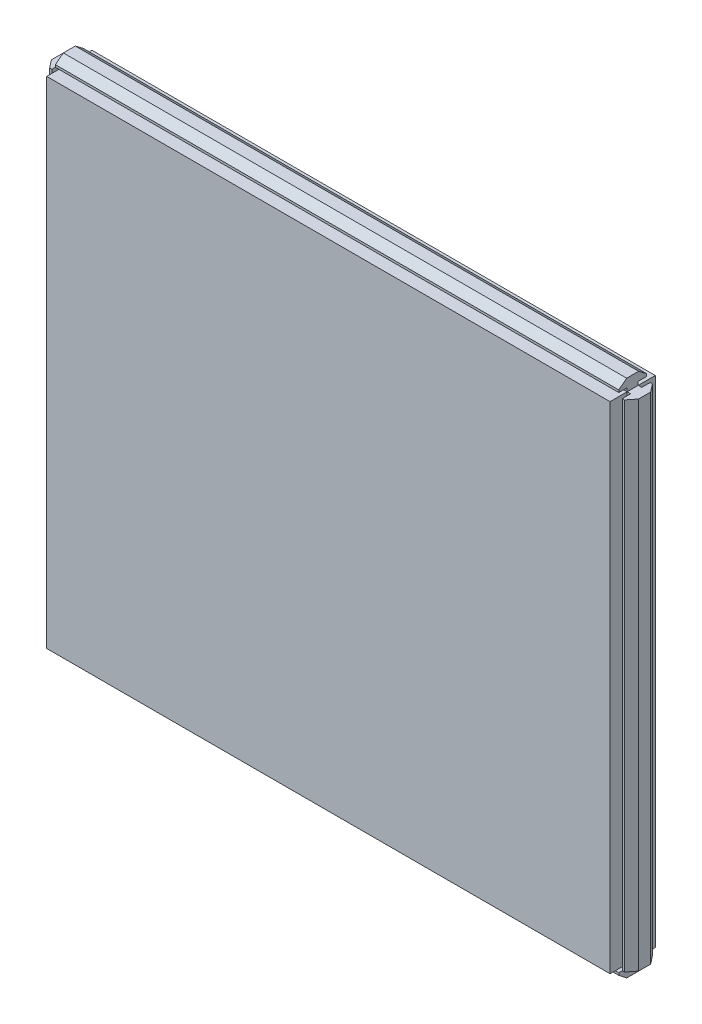
from build123d import *

# Parameters (mm, degrees)
BOSS_EXTRU_1_DEPTH            = 20
ENL_V_MAT_EXTRU_2_DEPTH       = 324.482768921
ENL_V_MAT_EXTRU_2_DEPTH_BACK  = 249
ENL_V_MAT_EXTRU_3_DEPTH       = 324.482768921
ENL_V_MAT_EXTRU_3_DEPTH_BACK  = 249
ENL_V_MAT_EXTRU_4_DEPTH       = 316.090774845
ENL_V_MAT_EXTRU_4_DEPTH_BACK  = 219
ENL_V_MAT_EXTRU_5_DEPTH       = 316.090774845
ENL_V_MAT_EXTRU_5_DEPTH_BACK  = 219
ENL_V_MAT_EXTRU_7_DEPTH       = 316.090774845
ENL_V_MAT_EXTRU_7_DEPTH_BACK  = 219
ENL_V_MAT_EXTRU_8_DEPTH       = 316.090774845
ENL_V_MAT_EXTRU_8_DEPTH_BACK  = 219
ENL_V_MAT_EXTRU_9_DEPTH       = 324.482768921
ENL_V_MAT_EXTRU_9_DEPTH_BACK  = 249
ENL_V_MAT_EXTRU_10_DEPTH      = 324.482768921
ENL_V_MAT_EXTRU_10_DEPTH_BACK = 249


with BuildPart() as part:
    # Esquisse1 → Boss.-Extru.1 (new body)
    with BuildSketch(Plane.XY):
        Polygon((-33.910103697, 30.671339951), (215.089896303, 30.671339951), (215.089896303, 25.371339951), (220.389896303, 25.371339951), (220.389896303, -193.628660049), (215.089896303, -193.628660049), (215.089896303, -198.928660049), (-33.910103697, -198.928660049), (-33.910103697, -193.628660049), (-39.210103697, -193.628660049), (-39.210103697, 25.371339951), (-33.910103697, 25.371339951), align=None)
    extrude(amount=BOSS_EXTRU_1_DEPTH)

    # Esquisse2 → Enlèv. mat.-Extru.2 (cut, two sides: drawn at the far end of the back side and taken through both)
    with BuildSketch(Plane(origin=(215.089896303, 0, 0), x_dir=(0, 0, -1), z_dir=(1, 0, 0)).offset(-ENL_V_MAT_EXTRU_2_DEPTH_BACK)):
        Polygon((-489.896433994, 25.371339951), (-20, 25.371339951), (-12.45, 25.371339951), (-12.45, 26.921339951), (-16.15, 26.921339951), (-16.15, 27.921339951), (-12.65, 30.671339951), (356.838183396, 320.983484048), (47.072753092, 1208.257969711), (-799.661864298, 912.645825614), align=None)
    extrude(amount=ENL_V_MAT_EXTRU_2_DEPTH + ENL_V_MAT_EXTRU_2_DEPTH_BACK, mode=Mode.SUBTRACT)

    # Esquisse3 → Enlèv. mat.-Extru.3 (cut, two sides: drawn at the far end of the back side and taken through both)
    with BuildSketch(Plane(origin=(215.089896303, 0, 0), x_dir=(0, 0, -1), z_dir=(1, 0, 0)).offset(-ENL_V_MAT_EXTRU_3_DEPTH_BACK)):
        Polygon((469.896433994, 25.371339951), (0, 25.371339951), (-7.55, 25.371339951), (-7.55, 26.921339951), (-3.85, 26.921339951), (-3.85, 28.020478953), (-7.35, 30.671339951), (-381.934453377, 314.377430771), (-79.989898168, 1204.343789854), (771.840989202, 915.337699034), align=None)
    extrude(amount=ENL_V_MAT_EXTRU_3_DEPTH + ENL_V_MAT_EXTRU_3_DEPTH_BACK, mode=Mode.SUBTRACT)

    # Esquisse5 → Enlèv. mat.-Extru.4 (cut, two sides: drawn at the far end of the back side and taken through both)
    with BuildSketch(Plane(origin=(0, 25.371339951, 0), x_dir=(1, 0, 0), z_dir=(0, 1, 0)).offset(-ENL_V_MAT_EXTRU_4_DEPTH_BACK)):
        Polygon((215.089896303, 0), (215.089896303, -7.55), (216.639896303, -7.55), (216.639896303, -3.85), (217.639896303, -3.85), (220.389896303, -7.35), (220.389896303, 0), align=None)
    extrude(amount=ENL_V_MAT_EXTRU_4_DEPTH + ENL_V_MAT_EXTRU_4_DEPTH_BACK, mode=Mode.SUBTRACT)

    # Esquisse7 → Enlèv. mat.-Extru.5 (cut, two sides: drawn at the far end of the back side and taken through both)
    with BuildSketch(Plane(origin=(0, 25.371339951, 0), x_dir=(1, 0, 0), z_dir=(0, 1, 0)).offset(-ENL_V_MAT_EXTRU_5_DEPTH_BACK)):
        Polygon((547.721673026, 403.954079466), (220.389896303, -12.65), (217.639896303, -16.15), (216.639896303, -16.15), (216.639896303, -12.45), (215.089896303, -12.45), (215.089896303, -20), (215.089896303, -549.816054004), (1215.620408753, -898.755730707), (1548.252185476, 55.014402763), align=None)
    extrude(amount=ENL_V_MAT_EXTRU_5_DEPTH + ENL_V_MAT_EXTRU_5_DEPTH_BACK, mode=Mode.SUBTRACT)

    # Esquisse9 → Enlèv. mat.-Extru.7 (cut, two sides: drawn at the far end of the back side and taken through both)
    with BuildSketch(Plane(origin=(0, 25.371339951, 0), x_dir=(1, 0, 0), z_dir=(0, 1, 0)).offset(-ENL_V_MAT_EXTRU_7_DEPTH_BACK)):
        Polygon((-33.910103697, -20), (-33.910103697, -12.45), (-35.460103697, -12.45), (-35.460103697, -16.15), (-36.460103697, -16.15), (-39.210103697, -12.65), (-39.210103697, -20), align=None)
    extrude(amount=ENL_V_MAT_EXTRU_7_DEPTH + ENL_V_MAT_EXTRU_7_DEPTH_BACK, mode=Mode.SUBTRACT)

    # Esquisse10 → Enlèv. mat.-Extru.8 (cut, two sides: drawn at the far end of the back side and taken through both)
    with BuildSketch(Plane(origin=(0, 25.371339951, 0), x_dir=(1, 0, 0), z_dir=(0, 1, 0)).offset(-ENL_V_MAT_EXTRU_8_DEPTH_BACK)):
        Polygon((-366.54188042, -423.954079466), (-39.210103697, -7.35), (-36.460103697, -3.85), (-35.460103697, -3.85), (-35.460103697, -7.55), (-33.910103697, -7.55), (-33.910103697, 0), (-33.910103697, 529.816054004), (-1034.440616146, 878.755730707), (-1367.072392869, -75.014402763), align=None)
    extrude(amount=ENL_V_MAT_EXTRU_8_DEPTH + ENL_V_MAT_EXTRU_8_DEPTH_BACK, mode=Mode.SUBTRACT)

    # Esquisse12 → Enlèv. mat.-Extru.9 (cut, two sides: drawn at the far end of the back side and taken through both)
    with BuildSketch(Plane.ZY.offset(33.910103697).offset(-ENL_V_MAT_EXTRU_9_DEPTH_BACK)):
        Polygon((20, -193.628660049), (12.45, -193.628660049), (12.45, -195.178660049), (16.15, -195.178660049), (16.15, -196.178660049), (12.65, -198.928660049), (20, -198.928660049), align=None)
    extrude(amount=ENL_V_MAT_EXTRU_9_DEPTH + ENL_V_MAT_EXTRU_9_DEPTH_BACK, mode=Mode.SUBTRACT)

    # Esquisse13 → Enlèv. mat.-Extru.10 (cut, two sides: drawn at the far end of the back side and taken through both)
    with BuildSketch(Plane.ZY.offset(33.910103697).offset(-ENL_V_MAT_EXTRU_10_DEPTH_BACK)):
        Polygon((376.838183396, -489.240804146), (7.35, -198.928660049), (3.85, -196.178660049), (3.85, -195.178660049), (7.55, -195.178660049), (7.55, -193.628660049), (0, -193.628660049), (-469.896433994, -193.628660049), (-779.661864298, -1080.903145712), (67.072753092, -1376.515289809), align=None)
    extrude(amount=ENL_V_MAT_EXTRU_10_DEPTH + ENL_V_MAT_EXTRU_10_DEPTH_BACK, mode=Mode.SUBTRACT)


solid = part.part
